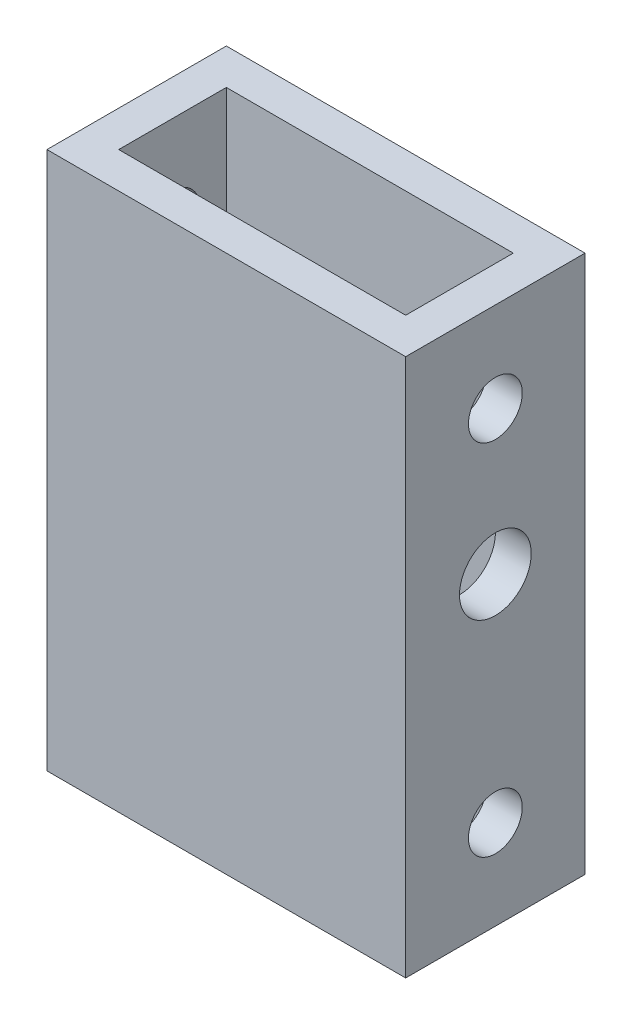
from build123d import *

# Parameters (mm, degrees)
SKETCH_1_W          = 20
SKETCH_1_H          = 10
SKETCH_1_W_2        = 16
SKETCH_1_H_2        = 6
EXTRUDE_1_DEPTH     = 15
SKETCH_2_R          = 2
SKETCH_2_R_2        = 1.5
CUT_EXTRUDE_1_DEPTH = 26.495097568


with BuildPart() as part:
    # 草图1 → 凸台-拉伸1 (new, symmetric)
    with BuildSketch(Plane(origin=(0, 0, 0), x_dir=(1, 0, 0), z_dir=(0, 1, 0))):
        Rectangle(SKETCH_1_W, SKETCH_1_H)
        Rectangle(SKETCH_1_W_2, SKETCH_1_H_2, mode=Mode.SUBTRACT)
    extrude(amount=EXTRUDE_1_DEPTH, both=True)

    # 草图2 → 切除-拉伸1 (cut, through all)
    with BuildSketch(Plane.ZY.offset(10)):
        with Locations((0, 2)):
            Circle(SKETCH_2_R)
        with Locations((0, 10)):
            Circle(SKETCH_2_R_2)
        with Locations((0, -10)):
            Circle(SKETCH_2_R_2)
    extrude(amount=-CUT_EXTRUDE_1_DEPTH, mode=Mode.SUBTRACT)


solid = part.part
